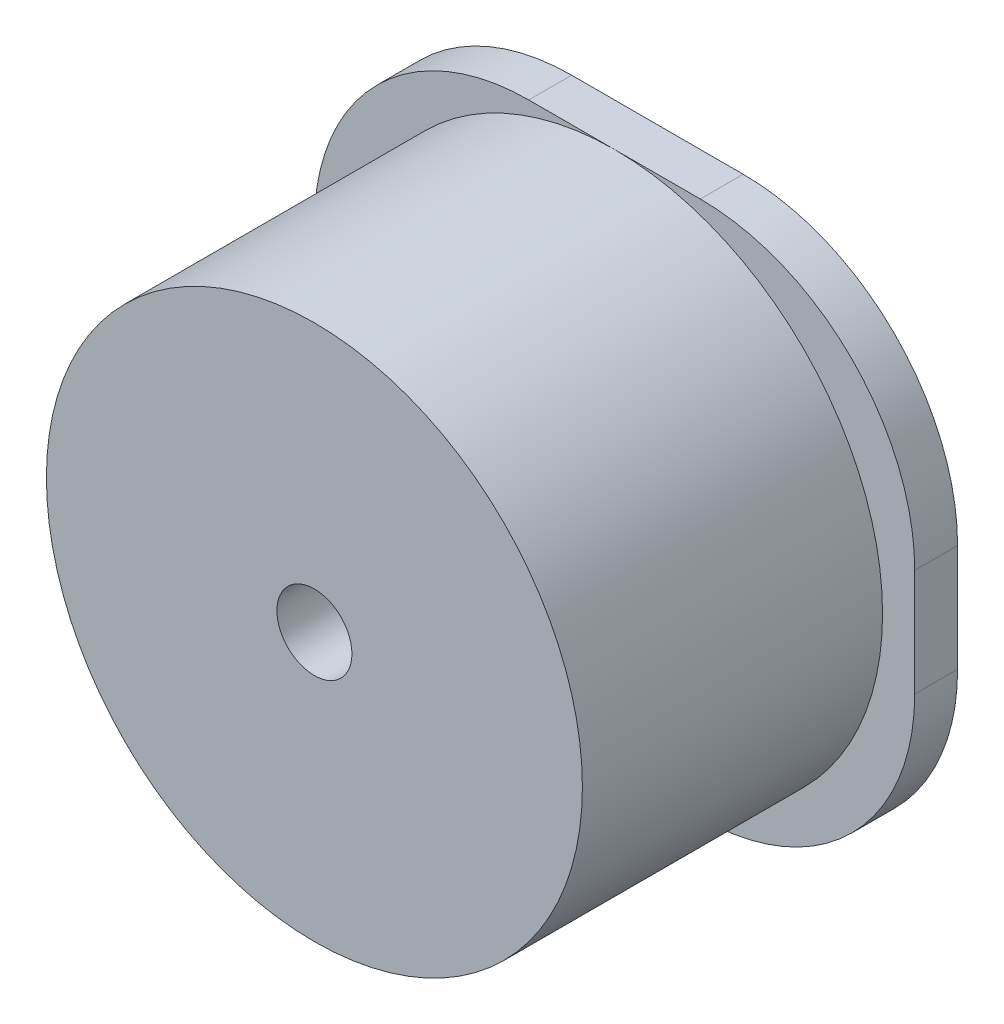
from build123d import *

# Parameters (mm, degrees)
SKETCH_1_R          = 12.5
EXTRUDE_1_DEPTH     = 14
SKETCH_2_R          = 1.75
CUT_EXTRUDE_1_DEPTH = 6
SKETCH_3_W          = 28
SKETCH_3_H          = 25
EXTRUDE_2_DEPTH     = 2
FILLET_1_R          = 10


with BuildPart() as part:
    # ｽｹｯﾁ1 → ﾎﾞｽ - 押し出し1 (new body)
    with BuildSketch(Plane.XY):
        Circle(SKETCH_1_R)
    extrude(amount=EXTRUDE_1_DEPTH)

    # ｽｹｯﾁ2 → ｶｯﾄ - 押し出し1 (cut)
    with BuildSketch(Plane.XY.offset(14)):
        Circle(SKETCH_2_R)
    extrude(amount=-CUT_EXTRUDE_1_DEPTH, mode=Mode.SUBTRACT)

    # ｽｹｯﾁ3 → ﾎﾞｽ - 押し出し2 (add)
    with BuildSketch(Plane(origin=(0, 0, 0), x_dir=(-1, 0, 0), z_dir=(0, 0, -1))):
        Rectangle(SKETCH_3_W, SKETCH_3_H)
    extrude(amount=EXTRUDE_2_DEPTH)

    # ﾌｨﾚｯﾄ1
    fillet_1_edges = [part.edges().sort_by_distance(p)[0] for p in [
        (14, 12.5, -1),
        (14, -12.5, -1),
        (-14, -12.5, -1),
        (-14, 12.5, -1),
    ]]
    fillet(fillet_1_edges, radius=FILLET_1_R)


solid = part.part
